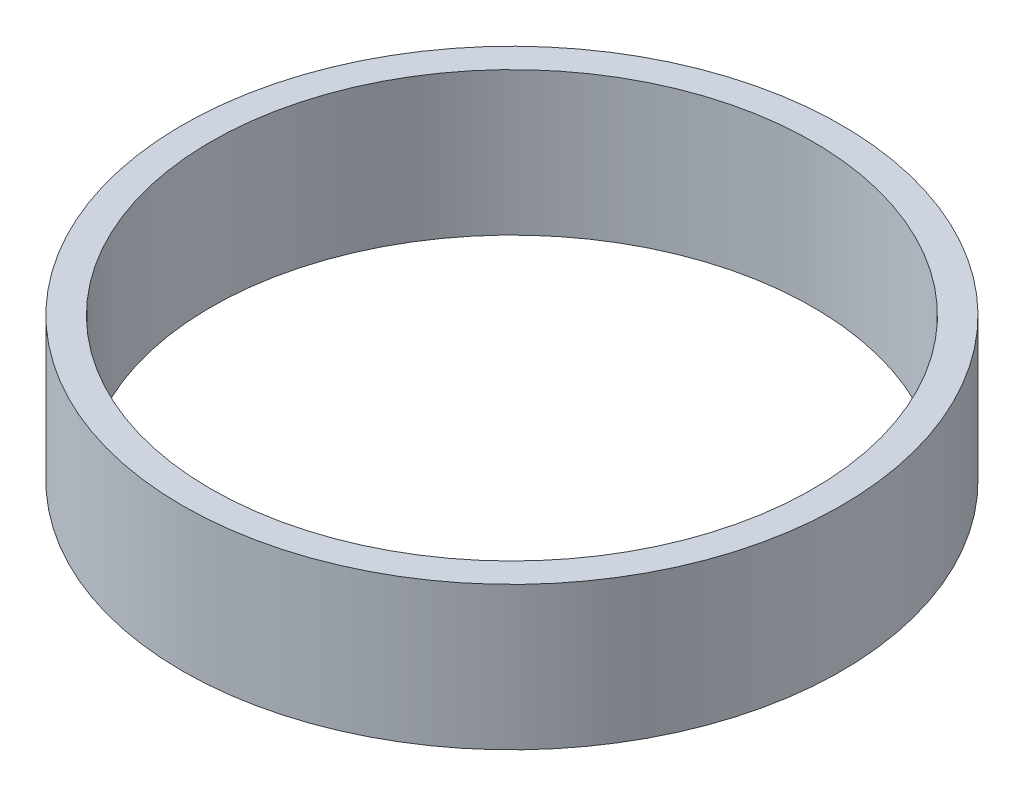
from build123d import *

# Parameters (mm, degrees)
SKETCH1_R           = 23
SKETCH1_R_2         = 21
BOSS_EXTRUDE1_DEPTH = 10


with BuildPart() as part:
    # Sketch1 → Boss-Extrude1 (new body)
    with BuildSketch(Plane(origin=(0, 0, 0), x_dir=(1, 0, 0), z_dir=(0, 1, 0))):
        with Locations(Location((0, 0, 0), (0, 0, 270))):
            Circle(SKETCH1_R)
        with Locations(Location((0, 0, 0), (0, 0, 270))):
            Circle(SKETCH1_R_2, mode=Mode.SUBTRACT)
    extrude(amount=BOSS_EXTRUDE1_DEPTH)


solid = part.part
